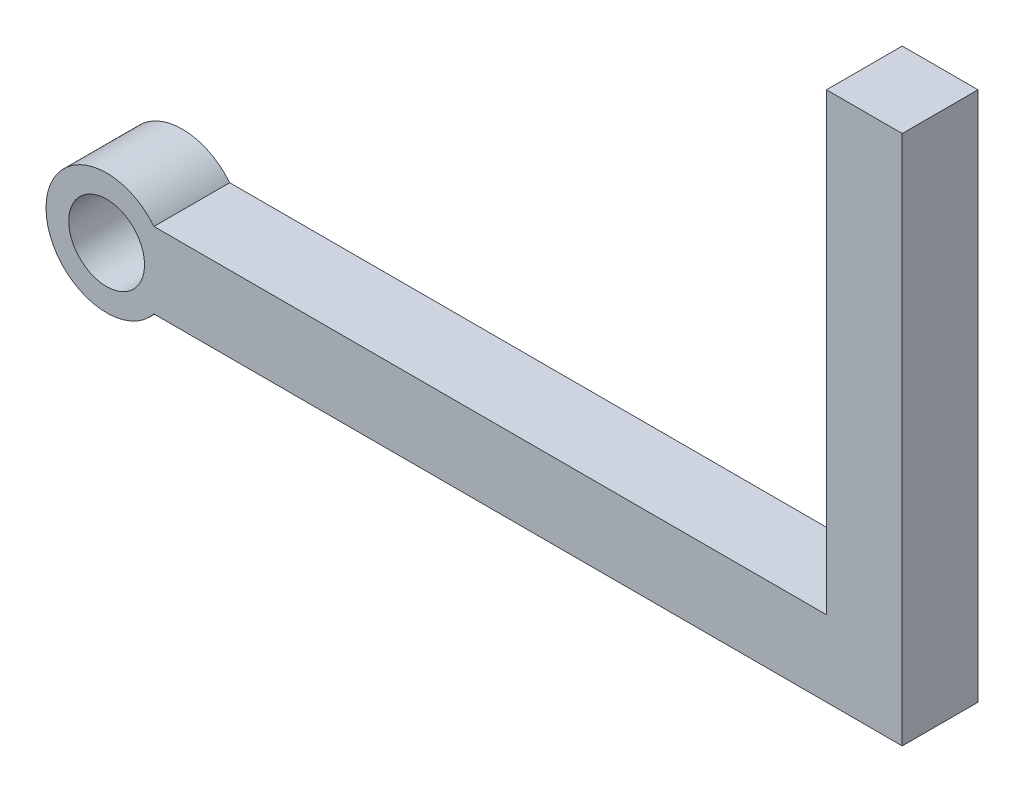
from build123d import *

# Parameters (mm, degrees)
SKETCH1_W                  = 127
SKETCH1_H                  = 12.7
BOSS_EXTRUDE1_DEPTH        = 12.7
SKETCH9_W                  = 12.7
SKETCH9_H                  = 12.7
BOSS_EXTRUDE2_DEPTH        = 76.2
SKETCH10_R                 = 10.16
BOSS_EXTRUDE3_DEPTH        = 12.7
F_1_2_0_5_DIAMETER_HOLE1_D = 12.7


with BuildPart() as part:
    # Sketch1 → Boss-Extrude1 (new body)
    with BuildSketch(Plane(origin=(0, 0, 0), x_dir=(1, 0, 0), z_dir=(0, 1, 0))):
        with Locations((0, 38.1)):
            Rectangle(SKETCH1_W, SKETCH1_H)
    extrude(amount=BOSS_EXTRUDE1_DEPTH)

    # Sketch9 → Boss-Extrude2 (add)
    with BuildSketch(Plane(origin=(0, 12.7, 0), x_dir=(1, 0, 0), z_dir=(0, 1, 0))):
        with Locations((57.15, 38.1)):
            Rectangle(SKETCH9_W, SKETCH9_H)
    extrude(amount=BOSS_EXTRUDE2_DEPTH)

    # Sketch10 → Boss-Extrude3 (add)
    with BuildSketch(Plane(origin=(0, 0, -44.45), x_dir=(-1, 0, 0), z_dir=(0, 0, -1))):
        with Locations((69.85, 6.35)):
            Circle(SKETCH10_R)
    extrude(amount=-BOSS_EXTRUDE3_DEPTH)

    # 1/2 (0.5) Diameter Hole1 (through all)
    with Locations(Plane(origin=(-69.85, 6.35, -44.45), x_dir=(-1, 0, 0), z_dir=(0, 0, -1))):
        with Locations((0, 0)):
            Hole(F_1_2_0_5_DIAMETER_HOLE1_D / 2)


solid = part.part
